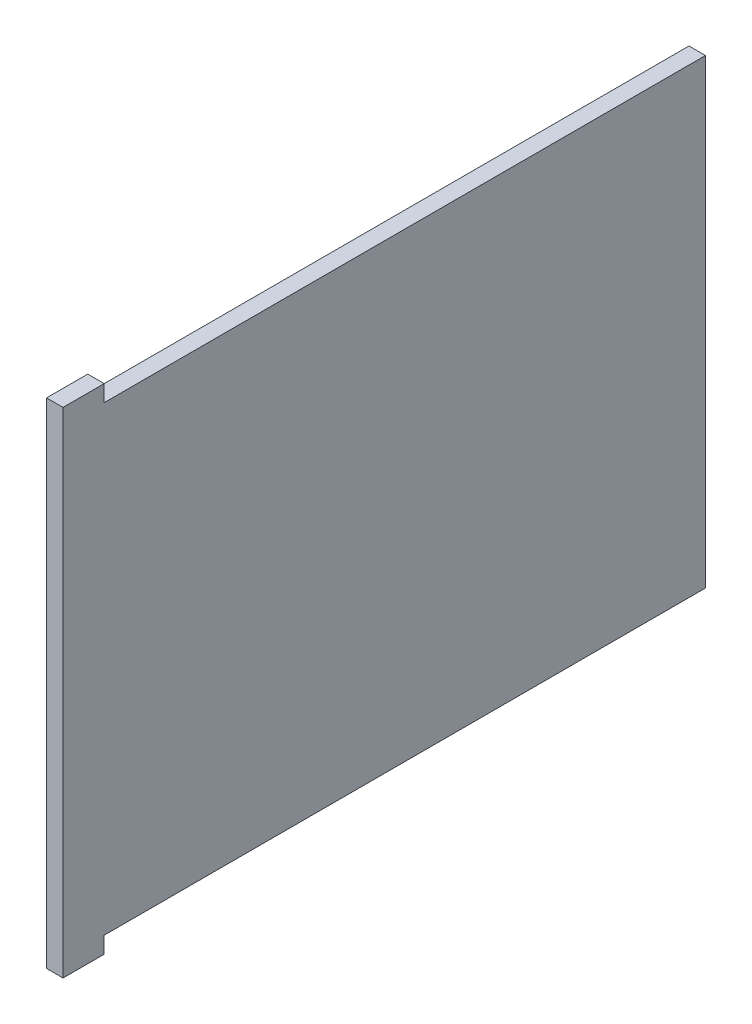
from build123d import *

# Parameters (mm, degrees)
EXTRUDE_1_DEPTH = 2


with BuildPart() as part:
    # 草图1 → 凸台-拉伸1 (new body)
    with BuildSketch(Plane(origin=(0, 0, 0), x_dir=(0, 0, -1), z_dir=(1, 0, 0))):
        Polygon((0, 60), (0, 0), (5, 0), (5, 2), (78, 2), (78, 58), (5, 58), (5, 60), align=None)
    extrude(amount=EXTRUDE_1_DEPTH)


solid = part.part
